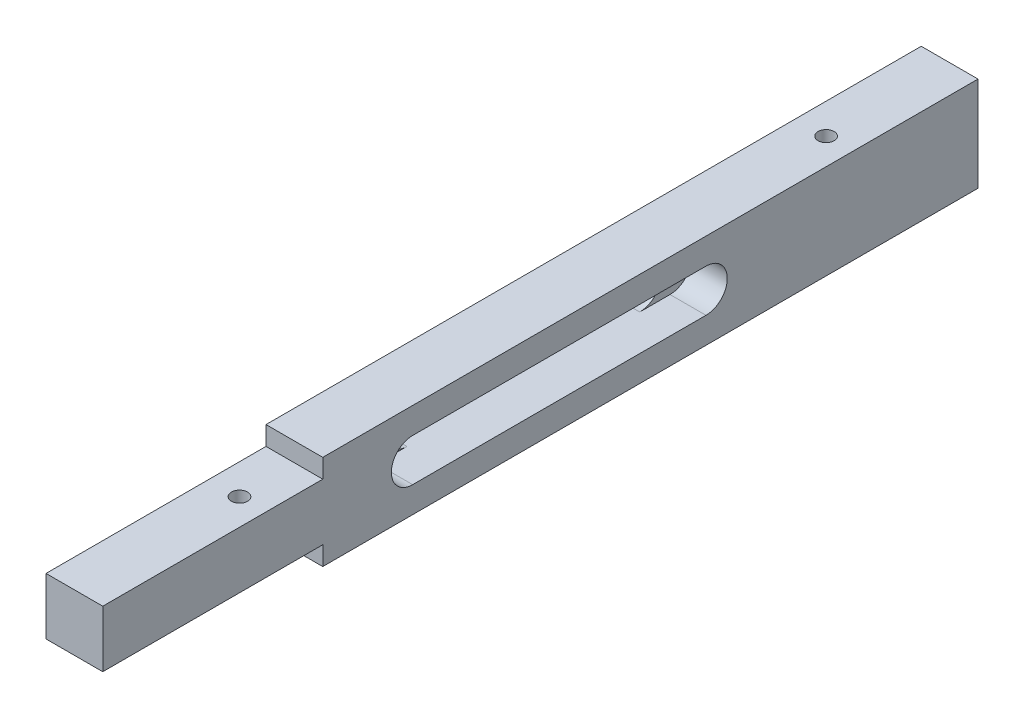
from build123d import *

# Parameters (mm, degrees)
EXTRUDE_1_DEPTH     = 6
CUT_EXTRUDE_1_DEPTH = 3.8
CUT_EXTRUDE_2_DEPTH = 49.87803699
SKETCH_3_W          = 18.536502565
SKETCH_3_H          = 15.637579157
CUT_EXTRUDE_3_DEPTH = 4
SKETCH_4_W          = 6
SKETCH_4_H          = 10
EXTRUDE_2_DEPTH     = 19.25
SKETCH_5_R          = 0.85
CUT_EXTRUDE_4_DEPTH = 50.639324129
SKETCH_6_R          = 0.85
CUT_EXTRUDE_5_DEPTH = 6


with BuildPart() as part:
    # 草图1 → 凸台-拉伸1 (new body)
    with BuildSketch(Plane(origin=(0, 0, 0), x_dir=(0, 0, -1), z_dir=(1, 0, 0))):
        Polygon((-25, 5), (25, 5), (25, 3), (48.25, 3), (48.25, -3), (25, -3), (25, -5), (-25, -5), (-25, -3), (-48.25, -3), (-48.25, 3), (-25, 3), align=None)
    extrude(amount=-EXTRUDE_1_DEPTH)

    # 草图1<3> → 切除-拉伸1 (cut)
    with BuildSketch(Plane(origin=(0, 0, 0), x_dir=(0, 0, -1), z_dir=(1, 0, 0))):
        with BuildLine():
            Line((-15.5, 2.25), (15.5, 2.25))
            ThreePointArc((15.5, 2.25), (17.75, 0), (15.5, -2.25))
            Line((15.5, -2.25), (-15.5, -2.25))
            ThreePointArc((-15.5, -2.25), (-17.75, 0), (-15.5, 2.25))
        make_face()
    extrude(amount=-CUT_EXTRUDE_1_DEPTH, mode=Mode.SUBTRACT)

    # 草图1<4> → 切除-拉伸2 (cut, through all)
    with BuildSketch(Plane(origin=(0, 0, 0), x_dir=(0, 0, -1), z_dir=(1, 0, 0))):
        with BuildLine():
            Line((-12.3, 2.25), (12.3, 2.25))
            ThreePointArc((12.3, 2.25), (14.55, 0), (12.3, -2.25))
            Line((12.3, -2.25), (-12.3, -2.25))
            ThreePointArc((-12.3, -2.25), (-14.55, 0), (-12.3, 2.25))
        make_face()
    extrude(amount=-CUT_EXTRUDE_2_DEPTH, mode=Mode.SUBTRACT)

    # 草图3 → 切除-拉伸3 (cut)
    with BuildSketch(Plane(origin=(0, 0, -48.25), x_dir=(-1, 0, 0), z_dir=(0, 0, -1))):
        with Locations((1.626975839, 1.766046581)):
            Rectangle(SKETCH_3_W, SKETCH_3_H)
    extrude(amount=-CUT_EXTRUDE_3_DEPTH, mode=Mode.SUBTRACT)

    # 草图4 → 凸台-拉伸2 (add)
    with BuildSketch(Plane(origin=(0, 0, -25), x_dir=(-1, 0, 0), z_dir=(0, 0, -1))):
        with Locations((3, 0)):
            Rectangle(SKETCH_4_W, SKETCH_4_H)
    extrude(amount=EXTRUDE_2_DEPTH)

    # 草图5 → 切除-拉伸4 (cut, through all)
    with BuildSketch(Plane.XZ.offset(5)):
        with Locations(Location((-2.8, 31, 0), (0, 0, 270))):
            Circle(SKETCH_5_R)
        with Locations(Location((-2.8, -31, 0), (0, 0, 270))):
            Circle(SKETCH_5_R)
    extrude(amount=-CUT_EXTRUDE_4_DEPTH, mode=Mode.SUBTRACT)

    # 草图6 → 切除-拉伸5 (cut)
    with BuildSketch(Plane(origin=(0, 0, -44.25), x_dir=(-1, 0, 0), z_dir=(0, 0, -1))):
        with Locations((3, 0)):
            Circle(SKETCH_6_R)
    extrude(amount=-CUT_EXTRUDE_5_DEPTH, mode=Mode.SUBTRACT)


solid = part.part
